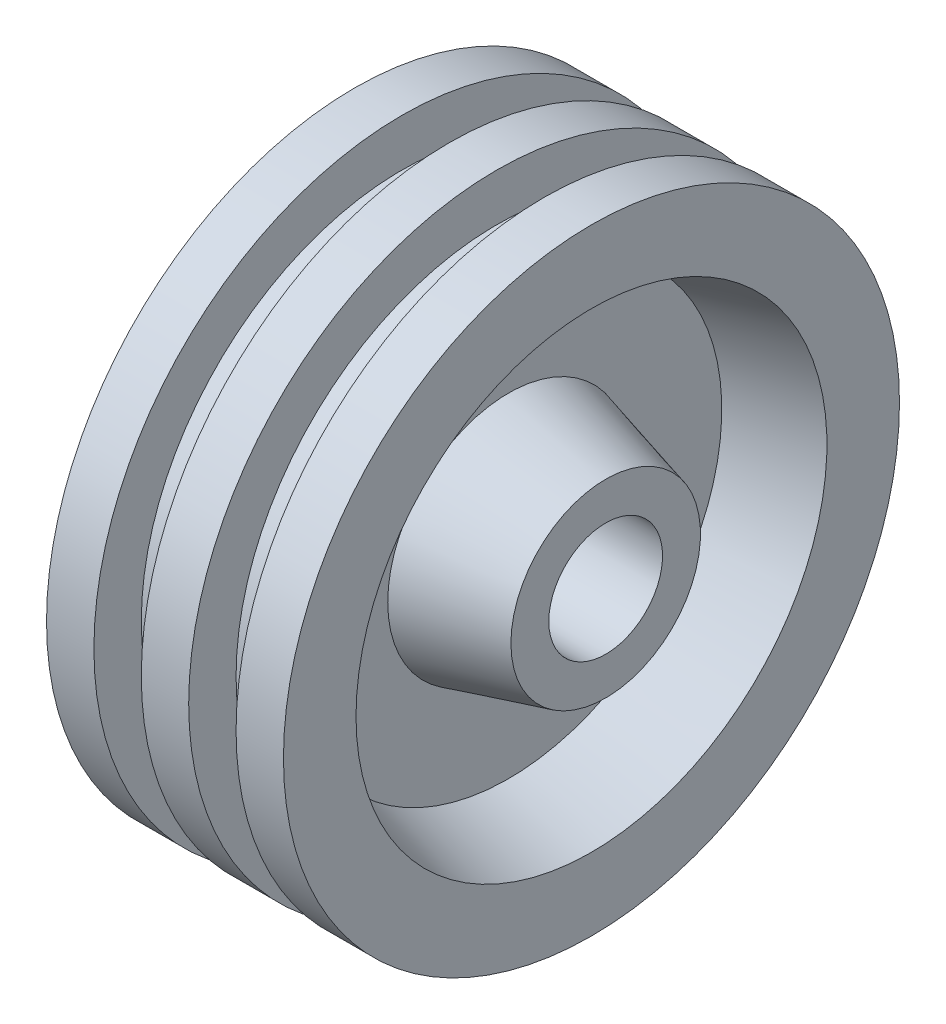
from build123d import *


with BuildPart() as part:
    # Эскиз1 → Повернуть1 (revolve)
    with BuildSketch(Plane.XY, mode=Mode.PRIVATE) as revolve_1_sk:
        Polygon((0, 65), (0, 49.689110868), (17.5, 45), (17.5, 20), (13, 20), (13, 12), (53, 12), (53, 20), (32.5, 25.492958445), (32.5, 45), (50, 49.689110868), (50, 65), (40, 65), (40, 55), (30, 55), (30, 65), (20, 65), (20, 55), (10, 55), (10, 65), align=None)
    revolve(revolve_1_sk.sketch.rotate(Axis((-926.28656243, 0, 0), (1, 0, 0)), 90), axis=Axis((-926.28656243, 0, 0), (1, 0, 0)))


solid = part.part
